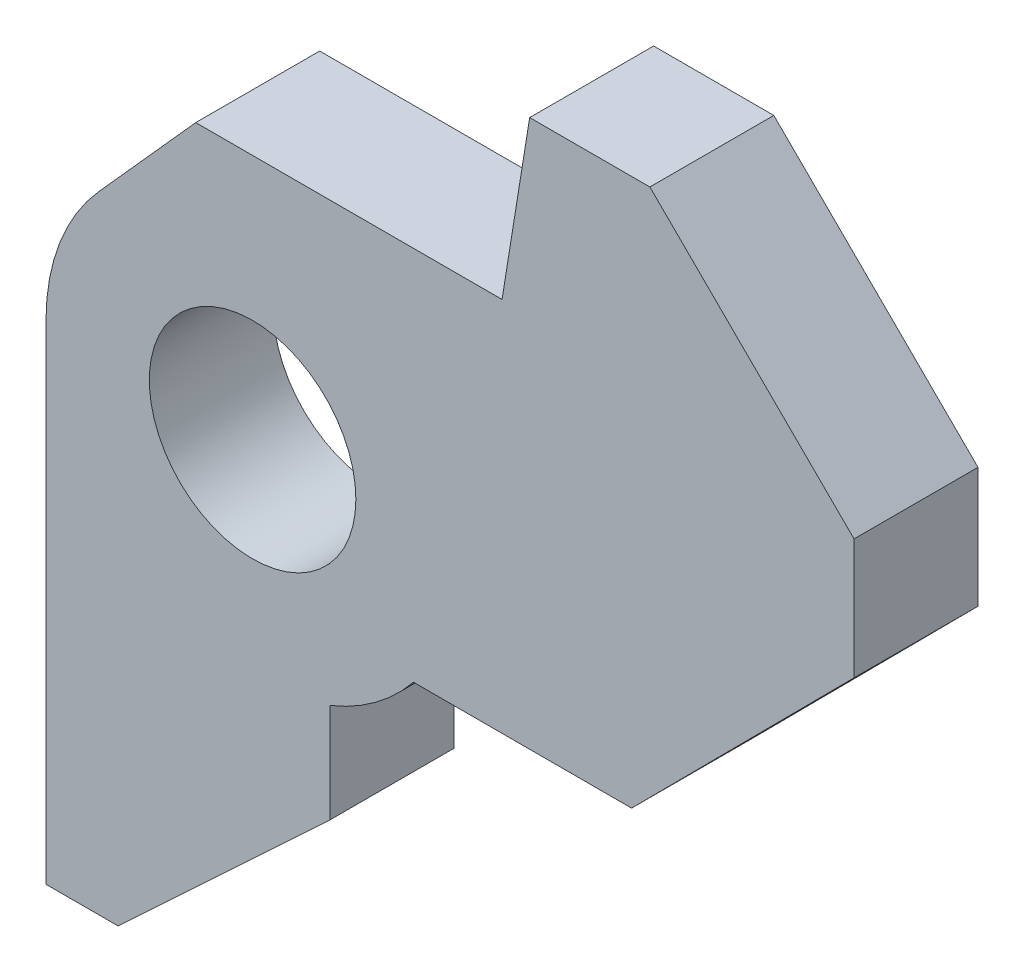
from build123d import *

# Parameters (mm, degrees)
SKETCH_1_R      = 2.5
EXTRUDE_1_DEPTH = 3


with BuildPart() as part:
    # 스케치1 → 보스-돌출1 (new body)
    with BuildSketch(Plane.XY):
        with BuildLine():
            Line((6.706268494, 10.103683016), (6.037882178, 5.957406269))
            Line((6.037882178, 5.957406269), (-1.376355668, 5.957406269))
            Line((-1.376355668, 5.957406269), (-3.724392512, 3.336000662))
            ThreePointArc((-3.724392512, 3.336000662), (-4.67022283, 1.785782383), (-5, 0))
            Line((-5, 0), (-5, -11.820871263))
            Line((-5, -11.820871263), (-3.253479839, -11.820871263))
            Line((-3.253479839, -11.820871263), (1.87605446, -7.031414053))
            Line((1.87605446, -7.031414053), (1.87605446, -4.634697365))
            ThreePointArc((1.87605446, -4.634697365), (2.980195691, -4.014776911), (3.893195608, -3.13736003))
            Line((3.893195608, -3.13736003), (9.172978659, -3.13736003))
            Line((9.172978659, -3.13736003), (14.557074242, 2.286312605))
            Line((14.557074242, 2.286312605), (14.557074242, 5.198022376))
            Line((14.557074242, 5.198022376), (9.615353398, 10.103683016))
            Line((9.615353398, 10.103683016), (6.706268494, 10.103683016))
        make_face()
        Circle(SKETCH_1_R, mode=Mode.SUBTRACT)
    extrude(amount=EXTRUDE_1_DEPTH)


solid = part.part
